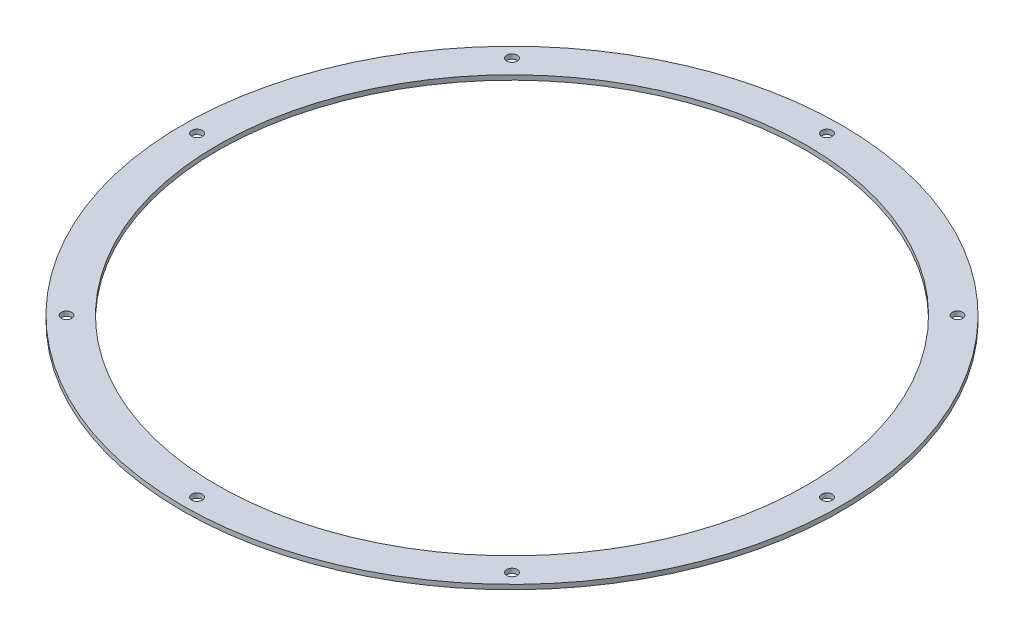
from build123d import *

# Parameters (mm, degrees)
SKETCH1_R           = 282.5
SKETCH1_R_2         = 252.5
BOSS_EXTRUDE1_DEPTH = 4
SKETCH2_R           = 4.5
CUT_EXTRUDE1_DEPTH  = 4
CIRPATTERN1_COUNT   = 8


with BuildPart() as part:
    # Sketch1 → Boss-Extrude1 (new body)
    with BuildSketch(Plane(origin=(0, 0, 0), x_dir=(1, 0, 0), z_dir=(0, 1, 0))):
        with Locations(Location((0, 0, 0), (0, 0, 270))):
            Circle(SKETCH1_R)
        with Locations(Location((0, 0, 0), (0, 0, 270))):
            Circle(SKETCH1_R_2, mode=Mode.SUBTRACT)
    extrude(amount=BOSS_EXTRUDE1_DEPTH)

    # Sketch2 → Cut-Extrude1 (cut)
    with BuildSketch(Plane(origin=(0, 4, 0), x_dir=(1, 0, 0), z_dir=(0, 1, 0))):
        with Locations(Location((0, 270, 0), (0, 0, 270))):
            Circle(SKETCH2_R)
    cut_extrude1 = extrude(amount=-CUT_EXTRUDE1_DEPTH, mode=Mode.SUBTRACT)

    # CirPattern1: Cut-Extrude1 ×8 about axis
    cirpattern1_axis = Axis((0, 0, 0), (0, 1, 0))
    for i in range(1, CIRPATTERN1_COUNT):
        add(cut_extrude1.rotate(cirpattern1_axis, i * 360 / CIRPATTERN1_COUNT), mode=Mode.SUBTRACT)


solid = part.part
